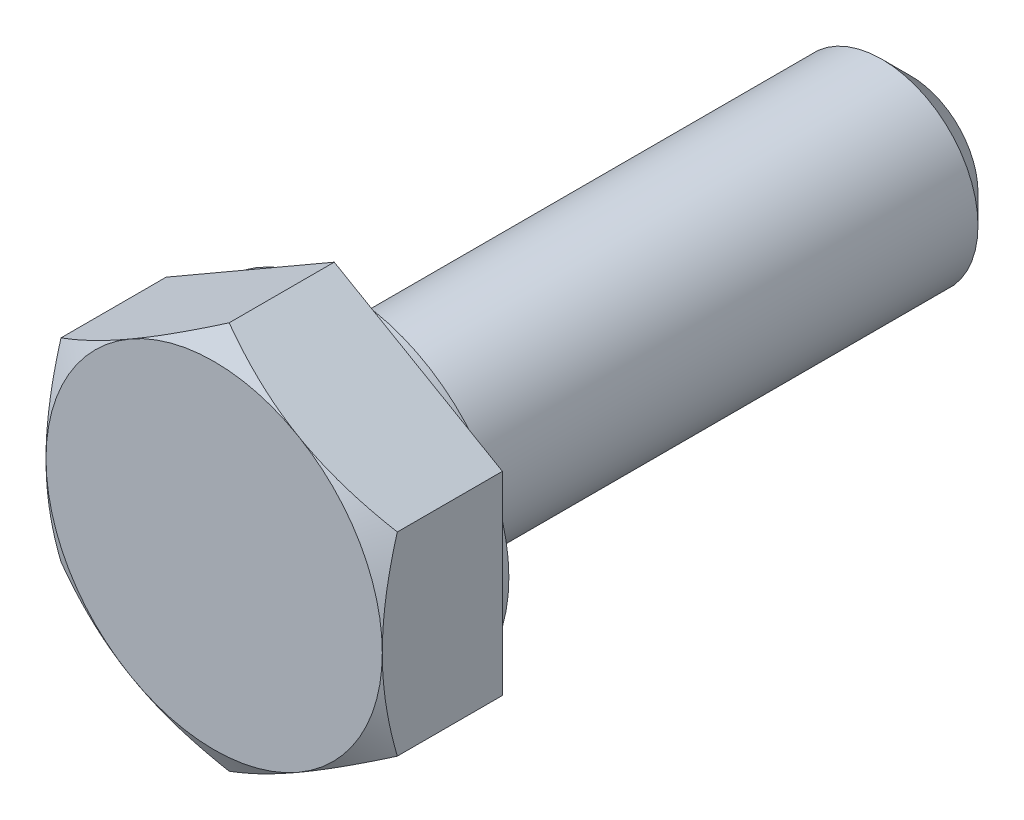
from build123d import *

# Parameters (mm, degrees)
SKETCH2_W           = 19.05
SKETCH2_H           = 3.175
BOSS_EXTRUDE1_DEPTH = 3.96875
SKETCH7_R           = 5.49275
BOSS_EXTRUDE2_DEPTH = 0.2778125
CHAMFER1_SIZE       = 0.9525
SKETCH4_OUTSIDE_W   = 107.284
SKETCH4_OUTSIDE_H   = 109.004
SKETCH4_OUTSIDE_R   = 5.55625
CUT_EXTRUDE1_DEPTH  = 25.533595695
CUT_EXTRUDE1_DRAFT  = -60


with BuildPart() as part:
    # Sketch2 → Revolve1 (revolve)
    with BuildSketch(Plane(origin=(0, 0, 0), x_dir=(0, 0, -1), z_dir=(1, 0, 0)), mode=Mode.PRIVATE) as revolve1_sk:
        with Locations((9.525, 1.5875)):
            Rectangle(SKETCH2_W, SKETCH2_H)
    revolve(revolve1_sk.sketch.rotate(Axis((0, 0, 0), (0, 0, -1)), 90), axis=Axis((0, 0, 0), (0, 0, -1)))

    # Sketch3 → Boss-Extrude1 (add)
    with BuildSketch(Plane.XY):
        Polygon((0, 6.415804866), (-5.55625, 3.207902433), (-5.55625, -3.207902433), (0, -6.415804866), (5.55625, -3.207902433), (5.55625, 3.207902433), align=None)
    extrude(amount=BOSS_EXTRUDE1_DEPTH)

    # Sketch7 → Boss-Extrude2 (add)
    with BuildSketch(Plane(origin=(0, 0, 0), x_dir=(-1, 0, 0), z_dir=(0, 0, -1))):
        with Locations(Location((0, 0, 0), (0, 0, 180))):
            Circle(SKETCH7_R)
    extrude(amount=BOSS_EXTRUDE2_DEPTH)

    # Chamfer1
    chamfer1_edges = [part.edges().sort_by_distance(p)[0] for p in [
        (-3.175, 0, -19.05),
    ]]
    chamfer(chamfer1_edges, length=CHAMFER1_SIZE)


with BuildPart() as cut_extrude1_tool:
    # Sketch4 outside → Cut-Extrude1 (with draft: the straight prism first)
    with BuildSketch(Plane.XY.offset(3.96875)):
        Rectangle(SKETCH4_OUTSIDE_W, SKETCH4_OUTSIDE_H)
        Circle(SKETCH4_OUTSIDE_R, mode=Mode.SUBTRACT)
    extrude(amount=-CUT_EXTRUDE1_DEPTH)
    # Cut-Extrude1: the draft: its side faces are tilted about the plane it starts from
    cut_extrude1_sides = [cut_extrude1_tool.faces().sort_by_distance(p)[0] for p in [
        (0, -54.502, -8.798047847),
        (53.642, 0, -8.798047847),
        (0, 54.502, -8.798047847),
        (-53.642, 0, -8.798047847),
        (-5.55625, 0, -8.798047847),
    ]]
    draft(cut_extrude1_sides, Plane.XY.offset(3.96875), CUT_EXTRUDE1_DRAFT)


with BuildPart() as part_1:
    add(part.part)

    # Cut-Extrude1: cut by cut_extrude1_tool
    add(cut_extrude1_tool.part, mode=Mode.SUBTRACT)


solid = part_1.part
